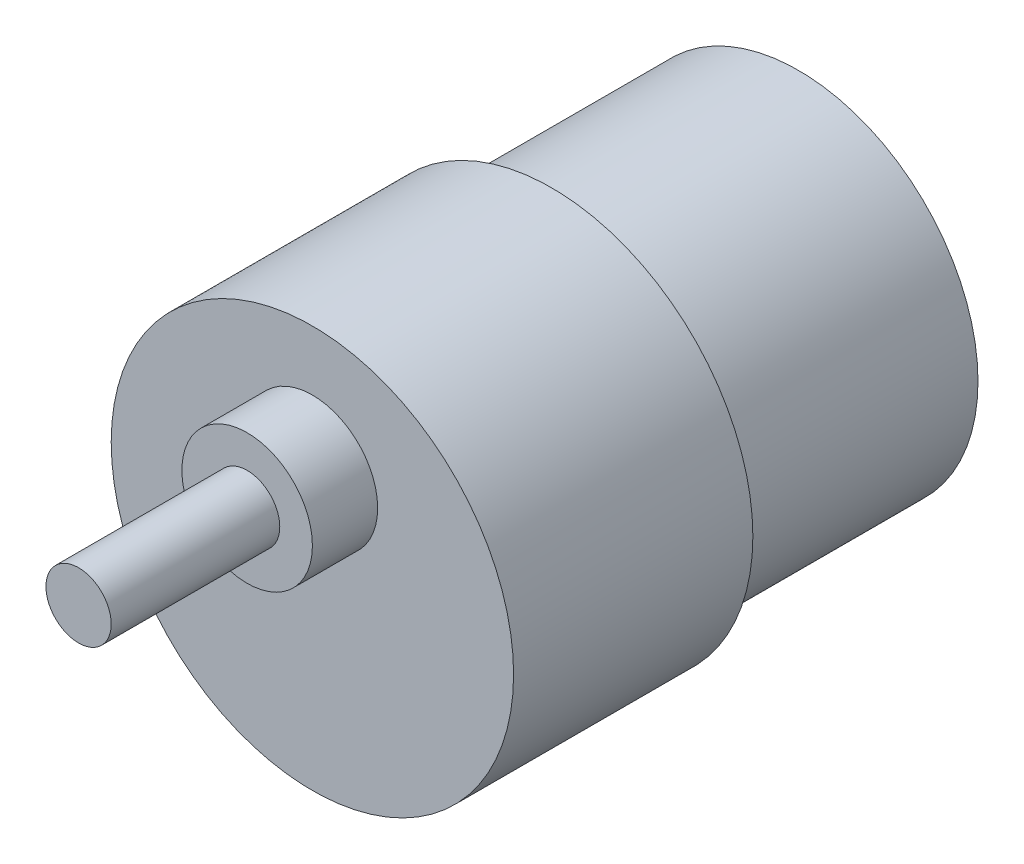
from build123d import *

# Parameters (mm, degrees)
SKETCH1_R           = 18.5
BOSS_EXTRUDE1_DEPTH = 22
SKETCH2_R           = 6
BOSS_EXTRUDE2_DEPTH = 6
SKETCH3_R           = 3
BOSS_EXTRUDE3_DEPTH = 15.5
SKETCH4_R           = 16.5
BOSS_EXTRUDE4_DEPTH = 22.7


with BuildPart() as part:
    # Sketch1 → Boss-Extrude1 (new body)
    with BuildSketch(Plane.XY):
        Circle(SKETCH1_R)
    extrude(amount=BOSS_EXTRUDE1_DEPTH)

    # Sketch2 → Boss-Extrude2 (add)
    with BuildSketch(Plane.XY.offset(22)):
        with Locations((0, 7)):
            Circle(SKETCH2_R)
    extrude(amount=BOSS_EXTRUDE2_DEPTH)

    # Sketch3 → Boss-Extrude3 (add)
    with BuildSketch(Plane.XY.offset(28)):
        with Locations((0, 7)):
            Circle(SKETCH3_R)
    extrude(amount=BOSS_EXTRUDE3_DEPTH)

    # Sketch4 → Boss-Extrude4 (add)
    with BuildSketch(Plane(origin=(0, 0, 0), x_dir=(-1, 0, 0), z_dir=(0, 0, -1))):
        Circle(SKETCH4_R)
    extrude(amount=BOSS_EXTRUDE4_DEPTH)


solid = part.part
